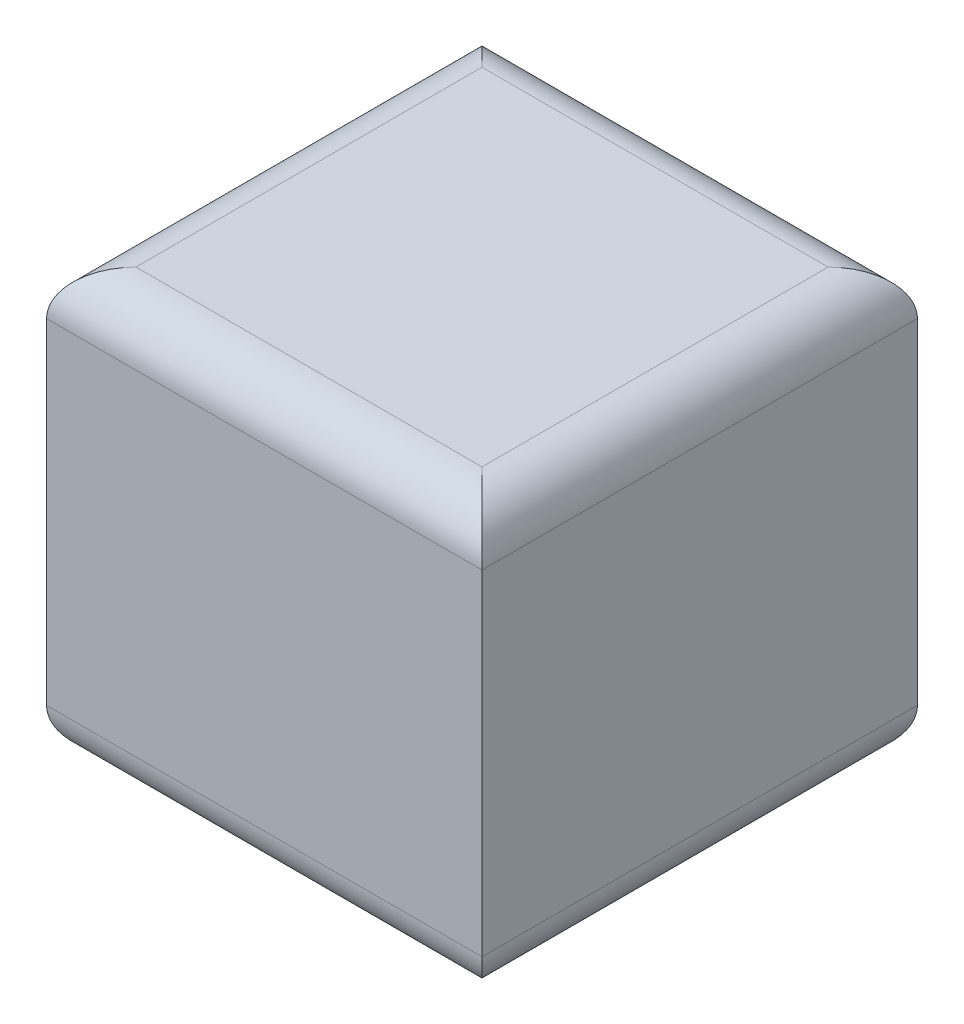
from build123d import *

# Parameters (mm, degrees)
SKETCH1_W           = 9.75
SKETCH1_H           = 9.75
BOSS_EXTRUDE1_DEPTH = 4.75
FILLET1_R           = 1


with BuildPart() as part:
    # Sketch1 → Boss-Extrude1 (new, symmetric)
    with BuildSketch(Plane(origin=(0, 0, 0), x_dir=(1, 0, 0), z_dir=(0, 1, 0))):
        Rectangle(SKETCH1_W, SKETCH1_H)
    extrude(amount=BOSS_EXTRUDE1_DEPTH, both=True)

    # Fillet1
    fillet1_edges = [part.edges().sort_by_distance(p)[0] for p in [
        (-4.875, 4.75, 0),
        (0, 4.75, 4.875),
        (4.875, 4.75, 0),
        (0, -4.75, 4.875),
        (-4.875, -4.75, 0),
        (0, -4.75, -4.875),
        (4.875, -4.75, 0),
        (0, 4.75, -4.875),
    ]]
    fillet(fillet1_edges, radius=FILLET1_R)


solid = part.part
